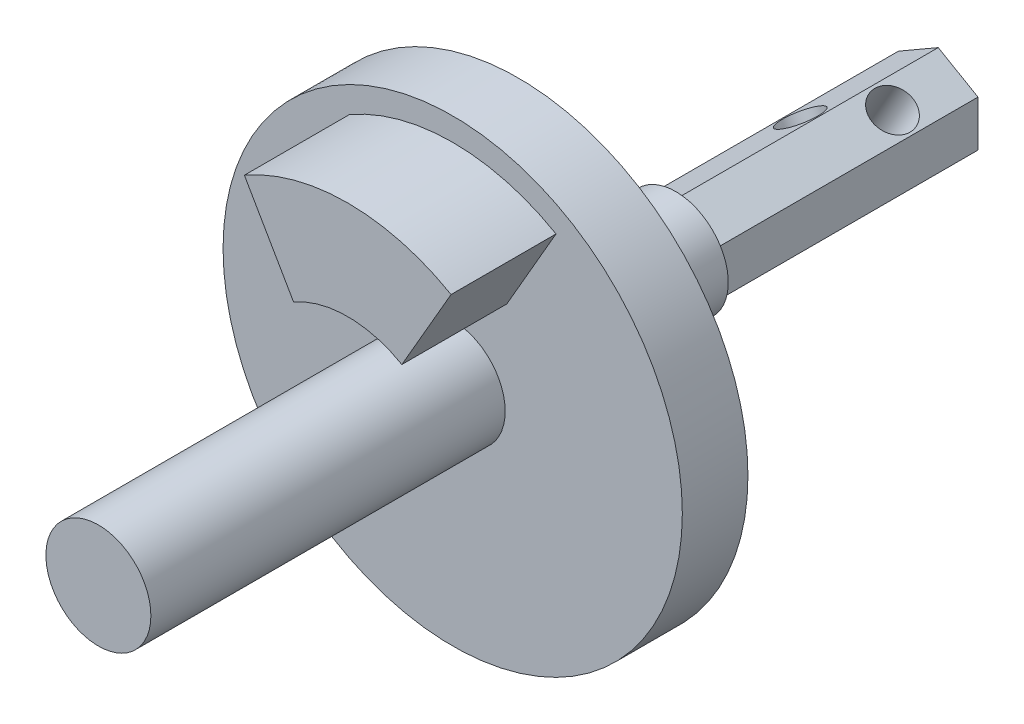
from build123d import *

# Parameters (mm, degrees)
SKETCH1_R           = 17.5
BOSS_EXTRUDE1_DEPTH = 2.5
BOSS_EXTRUDE2_DEPTH = 8
SKETCH3_R           = 4
BOSS_EXTRUDE3_DEPTH = 27
BOSS_EXTRUDE4_START = 12
SKETCH7_R           = 4
BOSS_EXTRUDE4_DEPTH = 12
BOSS_EXTRUDE5_DEPTH = 20
SKETCH10_R          = 1.55
CUT_EXTRUDE1_DEPTH  = 6.1
SKETCH11_R          = 1.55
CUT_EXTRUDE4_DEPTH  = 6.1


with BuildPart() as part:
    # Sketch1 → Boss-Extrude1 (new, symmetric)
    with BuildSketch(Plane.XY):
        Circle(SKETCH1_R)
    extrude(amount=BOSS_EXTRUDE1_DEPTH, both=True)

    # Sketch2 → Boss-Extrude2 (add)
    with BuildSketch(Plane.XY.offset(2.5)):
        with BuildLine():
            Line((7.875, 13.63990011), (4.125, 7.144709581))
            ThreePointArc((4.125, 7.144709581), (0, 8.25), (-4.125, 7.144709581))
            Line((-4.125, 7.144709581), (-7.875, 13.63990011))
            ThreePointArc((-7.875, 13.63990011), (0, 15.75), (7.875, 13.63990011))
        make_face()
    extrude(amount=BOSS_EXTRUDE2_DEPTH)

    # Sketch3 → Boss-Extrude3 (add)
    with BuildSketch(Plane.XY.offset(2.5)):
        Circle(SKETCH3_R)
    extrude(amount=BOSS_EXTRUDE3_DEPTH)

    # Sketch7 → Boss-Extrude4 (add)
    with BuildSketch(Plane(origin=(0, 0, -2.5), x_dir=(-1, 0, 0), z_dir=(0, 0, -1)).offset(BOSS_EXTRUDE4_START)):
        with Locations(Location((0, 0, 0), (0, 0, 180))):
            Circle(SKETCH7_R)
    extrude(amount=-BOSS_EXTRUDE4_DEPTH)

    # Sketch9 → Boss-Extrude5 (add)
    with BuildSketch(Plane(origin=(0, 0, -14.5), x_dir=(-1, 0, 0), z_dir=(0, 0, -1))):
        Polygon((0, 3.5), (-3.031088913, 1.75), (-3.031088913, -1.75), (0, -3.5), (3.031088913, -1.75), (3.031088913, 1.75), align=None)
    extrude(amount=BOSS_EXTRUDE5_DEPTH)

    # Sketch10 → Cut-Extrude1 (cut)
    with BuildSketch(Plane(origin=(-1.515544457, -2.625, 0), x_dir=(0.866025403784435, -0.5000000000000062, 0), z_dir=(-0.5000000000000062, -0.866025403784435, 0))):
        with Locations((0, -29.5)):
            Circle(SKETCH10_R)
    extrude(amount=-CUT_EXTRUDE1_DEPTH, mode=Mode.SUBTRACT)

    # Sketch11 → Cut-Extrude4 (cut)
    with BuildSketch(Plane(origin=(1.515544457, -2.625, 0), x_dir=(0, 0, 1), z_dir=(-0.49999999999999717, 0.8660254037844404, 0))):
        with Locations(Location((-25.5, 0, 0), (0, 0, 90))):
            Circle(SKETCH11_R)
    extrude(amount=CUT_EXTRUDE4_DEPTH, mode=Mode.SUBTRACT)


solid = part.part
